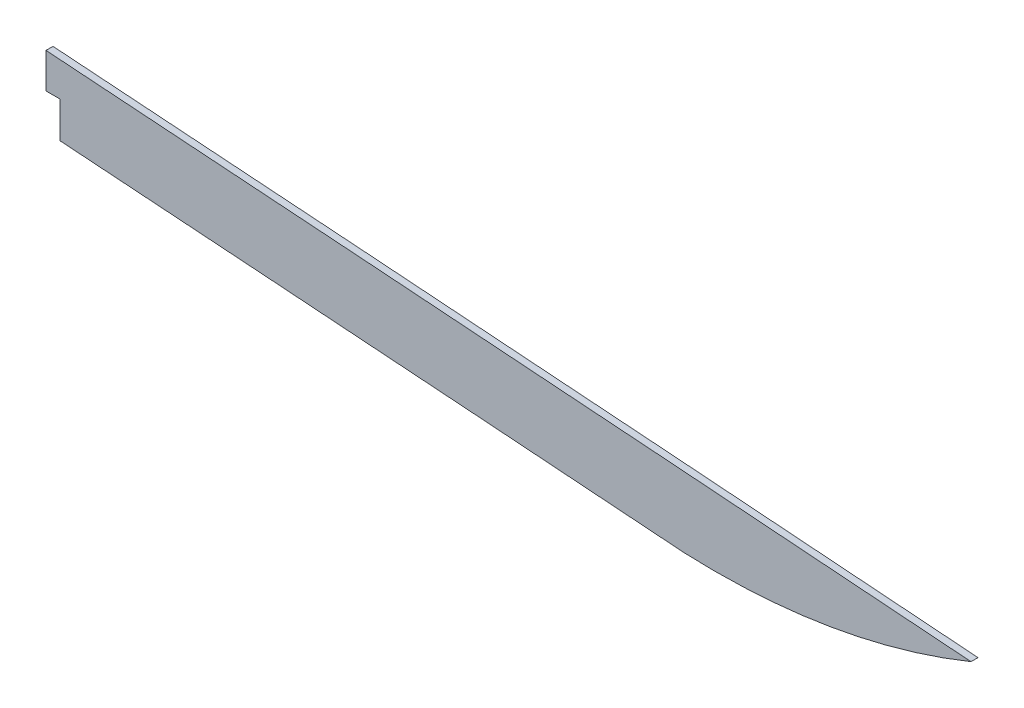
from build123d import *

# Parameters (mm, degrees)
BOSS_EXTRUDE1_DEPTH = 10


with BuildPart() as part:
    # Sketch1 → Boss-Extrude1 (new body)
    with BuildSketch(Plane.XY):
        with BuildLine():
            Line((8e-09, 1e-09), (8e-09, -50.121840767))
            Line((8e-09, -50.121840767), (20.000000008, -50.121840767))
            Line((20.000000008, -50.121840767), (20.000000008, -101.641774289))
            ThreePointArc((20.000000008, -101.641774289), (465.566882769, -133.179218179), (911.080534453, -165.459917439))
            add(Edge.make_bspline(
                [(1319.077974178, -95.398302795), (1125.124112684, -174.190190217), (911.080534453, -165.459917439)],
                knots=[0, 0, 0, 1, 1, 1], degree=2))
            ThreePointArc((1319.077974178, -95.398302795), (659.597864045, -46.885056293), (8e-09, 1e-09))
        make_face()
    extrude(amount=BOSS_EXTRUDE1_DEPTH)


solid = part.part
